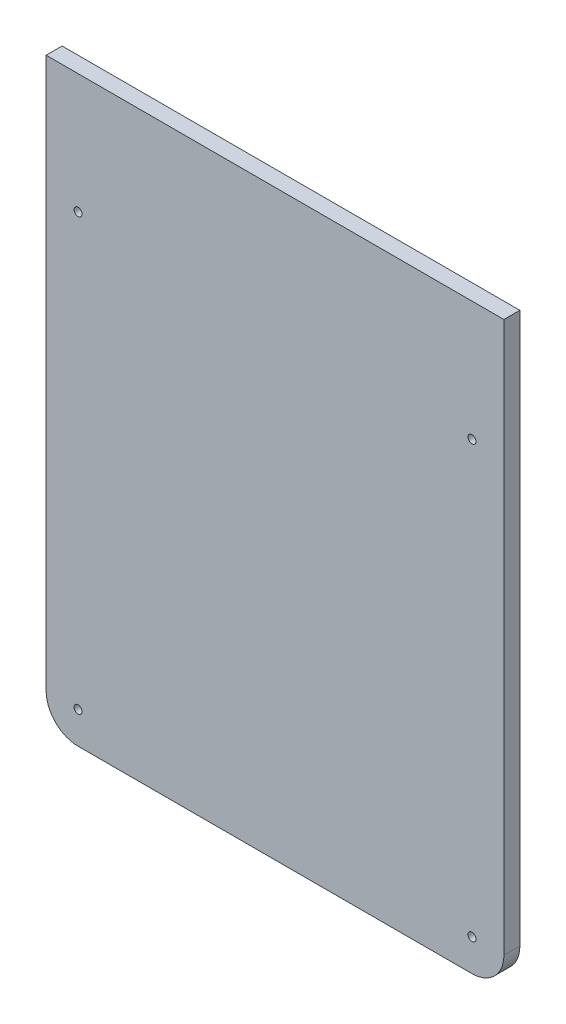
from build123d import *

# Parameters (mm, degrees)
BOSS_EXTRUDE1_DEPTH = 6.35
HOLE1_D             = 3.175
HOLE1_DEPTH         = 31.75
HOLE1_CSINK_D       = 10.16
HOLE1_CSINK_ANGLE   = 82
HOLE1_TIP           = 0.953866233


with BuildPart() as part:
    # Sketch1 → Boss-Extrude1 (new body)
    with BuildSketch(Plane.XY):
        with BuildLine():
            Line((-19.05, 903.02716301), (163.099999994, 903.02716301))
            Line((163.099999994, 903.02716301), (163.099999994, 683.95216301))
            ThreePointArc((163.099999994, 683.95216301), (159.380256115, 674.971906889), (150.399999994, 671.25216301))
            Line((150.399999994, 671.25216301), (-6.35, 671.25216301))
            ThreePointArc((-6.35, 671.25216301), (-15.330256121, 674.971906889), (-19.05, 683.95216301))
            Line((-19.05, 683.95216301), (-19.05, 903.02716301))
        make_face()
    extrude(amount=BOSS_EXTRUDE1_DEPTH)

    # Hole1
    with Locations(Plane(origin=(72.024999997, -422.259782605, 19.05), x_dir=(1, 0, 0), z_dir=(0, 0, 1))):
        with Locations((-78.374999997, 1277.661945614), (-78.374999997, 1106.211945614), (78.374999997, 1106.211945614), (78.374999997, 1277.661945614)):
            CounterSinkHole(HOLE1_D / 2, HOLE1_CSINK_D / 2, depth=HOLE1_DEPTH, counter_sink_angle=HOLE1_CSINK_ANGLE)
            with Locations((0, 0, -(HOLE1_DEPTH + HOLE1_TIP / 2))):  # 118° drill point
                Cone(0, HOLE1_D / 2, HOLE1_TIP, mode=Mode.SUBTRACT)


solid = part.part
